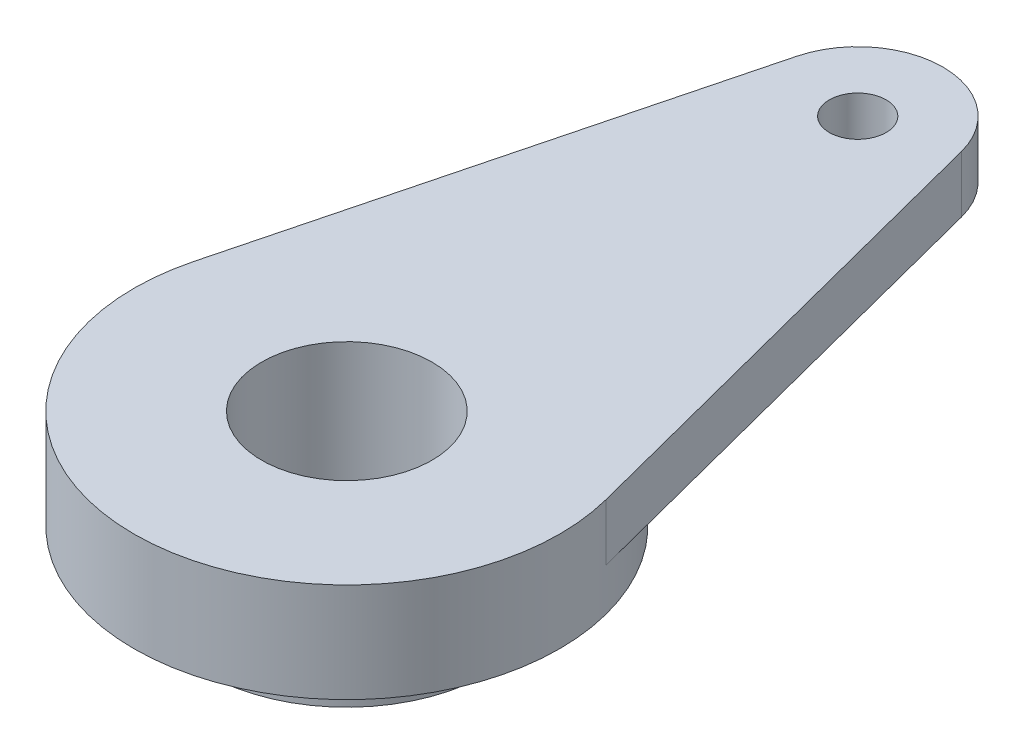
from build123d import *

# Parameters (mm, degrees)
SKETCH_1_R          = 5
EXTRUDE_1_DEPTH     = 2
SKETCH_2_R          = 7.5
EXTRUDE_2_DEPTH     = 1.5
SKETCH_3_R          = 1
EXTRUDE_3_DEPTH     = 2
SKETCH_4_R          = 3
CUT_EXTRUDE_1_DEPTH = 23.967368156


with BuildPart() as part:
    # 草图1 → 凸台-拉伸1 (new body)
    with BuildSketch(Plane(origin=(0, 0, 0), x_dir=(1, 0, 0), z_dir=(0, 1, 0))):
        with Locations(Location((0, 0, 0), (0, 0, 270))):
            Circle(SKETCH_1_R)
    extrude(amount=EXTRUDE_1_DEPTH)

    # 草图2 → 凸台-拉伸2 (add)
    with BuildSketch(Plane(origin=(0, 2, 0), x_dir=(1, 0, 0), z_dir=(0, 1, 0))):
        with Locations(Location((0, 0, 0), (0, 0, 270))):
            Circle(SKETCH_2_R)
    extrude(amount=EXTRUDE_2_DEPTH)

    # 草图3 → 凸台-拉伸3 (add)
    with BuildSketch(Plane(origin=(0, 3.5, 0), x_dir=(1, 0, 0), z_dir=(0, 1, 0))):
        with BuildLine():
            Line((-2.90473751, 18.75), (-7.261843774, 1.875))
            ThreePointArc((-7.261843774, 1.875), (0, -7.5), (7.261843774, 1.875))
            Line((7.261843774, 1.875), (2.90473751, 18.75))
            ThreePointArc((2.90473751, 18.75), (0, 21), (-2.90473751, 18.75))
        make_face()
        with Locations(Location((0, 18, 0), (0, 0, 270))):
            Circle(SKETCH_3_R, mode=Mode.SUBTRACT)
    extrude(amount=EXTRUDE_3_DEPTH)

    # 草图4 → 切除-拉伸1 (cut, through all)
    with BuildSketch(Plane.XZ):
        with Locations(Location((0, 0, 0), (0, 0, 270))):
            Circle(SKETCH_4_R)
    extrude(amount=-CUT_EXTRUDE_1_DEPTH, mode=Mode.SUBTRACT)


solid = part.part
